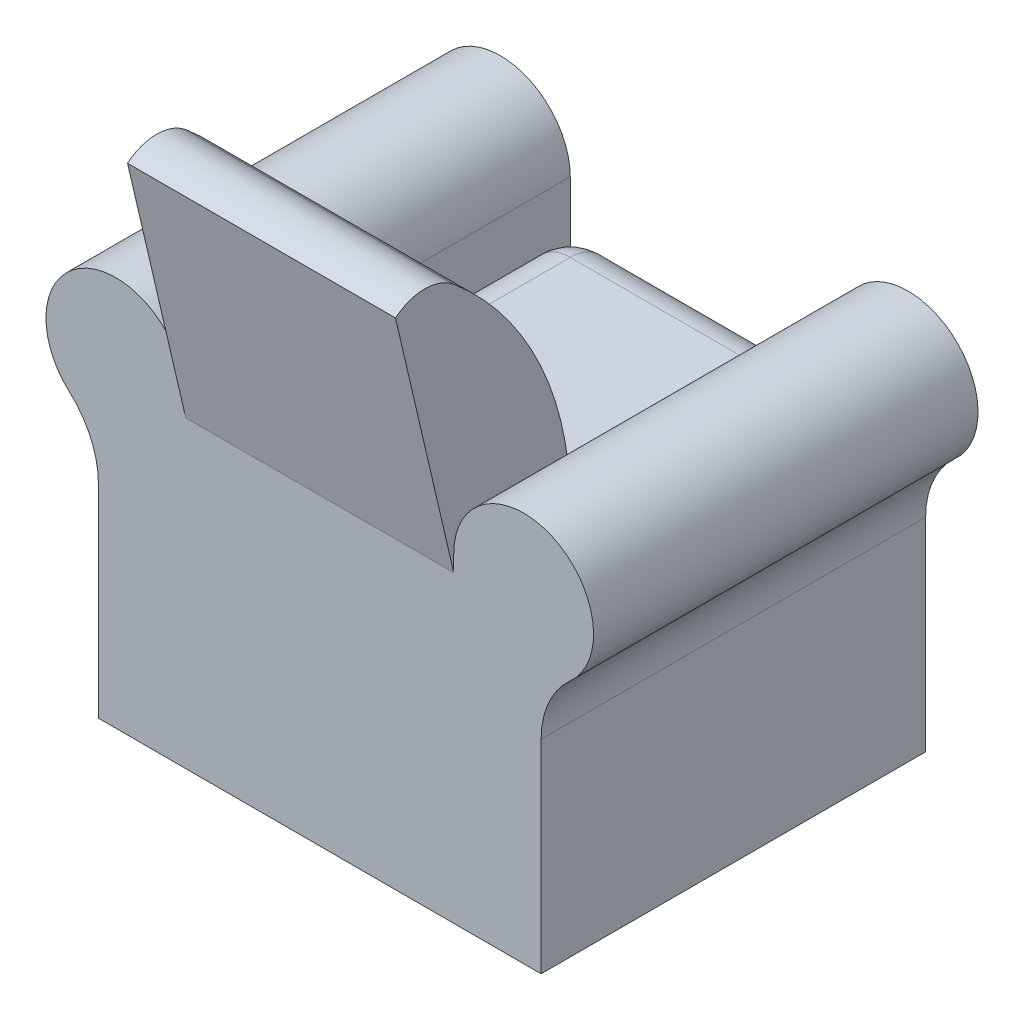
from build123d import *

# Parameters (mm, degrees)
SKETCH2_W           = 460
SKETCH2_H           = 460
BOSS_EXTRUDE1_DEPTH = 350
SKETCH3_W           = 460
SKETCH3_H           = 460
BOSS_EXTRUDE2_DEPTH = 150
FILLET1_R           = 70
BOSS_EXTRUDE3_DEPTH = 460
BOSS_EXTRUDE4_REACH = 1254.153


with BuildPart() as part:
    # Sketch2 → Boss-Extrude1 (new body)
    with BuildSketch(Plane(origin=(0, 0, 0), x_dir=(1, 0, 0), z_dir=(0, 1, 0))):
        Rectangle(SKETCH2_W, SKETCH2_H)
    extrude(amount=BOSS_EXTRUDE1_DEPTH)



with BuildPart() as body_2:
    # Sketch3 → Boss-Extrude2 (new body)
    with BuildSketch(Plane(origin=(0, 350, 0), x_dir=(1, 0, 0), z_dir=(0, 1, 0))):
        Rectangle(SKETCH3_W, SKETCH3_H)
    extrude(amount=BOSS_EXTRUDE2_DEPTH)

    # Fillet1
    fillet1_edges = [body_2.edges().sort_by_distance(p)[0] for p in [
        (0, 500, 230),
        (230, 500, 0),
        (0, 500, -230),
        (230, 350, 0),
        (0, 350, 230),
        (-230, 350, 0),
        (0, 350, -230),
        (230, 425, -230),
        (230, 425, 230),
        (-230, 425, 230),
        (-230, 425, -230),
        (-230, 500, 0),
    ]]
    fillet(fillet1_edges, radius=FILLET1_R)


with BuildPart() as part_1:
    add(part.part)

    add(body_2.part)  # Boss-Extrude3 merges body 2
    # Sketch4 → Boss-Extrude3 (add)
    with BuildSketch(Plane.ZY.offset(230)):
        with BuildLine():
            Line((230, 0), (230, 521.319166655))
            ThreePointArc((230, 521.319166655), (282.459718261, 757.839386127), (430, 950))
            ThreePointArc((430, 950), (480, 968.18735527), (530, 950))
            Line((530, 950), (430, 521.319166655))
            Line((430, 521.319166655), (430, 0))
            Line((430, 0), (230, 0))
        make_face()
    extrude(amount=-BOSS_EXTRUDE3_DEPTH)

    # Boss-Extrude4: up to this face of the body (flat: up to its plane)
    boss_extrude4_end = Plane(part_1.part.faces().sort_by_distance((0, 260.659583327, 430))[0])
    # Sketch5 → Boss-Extrude4 (add, up to the picked face)
    with BuildSketch(Plane(origin=(0, 0, -230), x_dir=(-1, 0, 0), z_dir=(0, 0, -1)), mode=Mode.PRIVATE) as boss_extrude4_sk1:
        with BuildLine():
            Line((230, 0), (230, 550))
            ThreePointArc((230, 550), (398.989794856, 659.544511501), (430, 460.5572809))
            ThreePointArc((430, 460.5572809), (393.069360624, 409.991125595), (380, 348.753882025))
            Line((380, 348.753882025), (380, 0))
            Line((380, 0), (230, 0))
        make_face()
    boss_extrude4_tool1 = split(extrude(boss_extrude4_sk1.sketch, amount=-BOSS_EXTRUDE4_REACH, mode=Mode.PRIVATE), bisect_by=boss_extrude4_end, keep=Keep.BOTH, mode=Mode.PRIVATE)
    # Sketch5 → Boss-Extrude4 (add, up to the picked face)
    with BuildSketch(Plane(origin=(0, 0, -230), x_dir=(-1, 0, 0), z_dir=(0, 0, -1)), mode=Mode.PRIVATE) as boss_extrude4_sk2:
        with BuildLine():
            Line((-380, 0), (-230, 0))
            Line((-230, 0), (-230, 550))
            ThreePointArc((-230, 550), (-398.989794856, 659.544511501), (-430, 460.5572809))
            ThreePointArc((-430, 460.5572809), (-393.069360624, 409.991125595), (-380, 348.753882025))
            Line((-380, 348.753882025), (-380, 0))
        make_face()
    boss_extrude4_tool2 = split(extrude(boss_extrude4_sk2.sketch, amount=-BOSS_EXTRUDE4_REACH, mode=Mode.PRIVATE), bisect_by=boss_extrude4_end, keep=Keep.BOTH, mode=Mode.PRIVATE)
    add(boss_extrude4_tool1.solids().sort_by(Axis((-322.302459, 356.474998, -230), (0, 0, 1)))[0])
    add(boss_extrude4_tool2.solids().sort_by(Axis((322.302459, 356.474998, -230), (0, 0, 1)))[0])


solid = part_1.part
